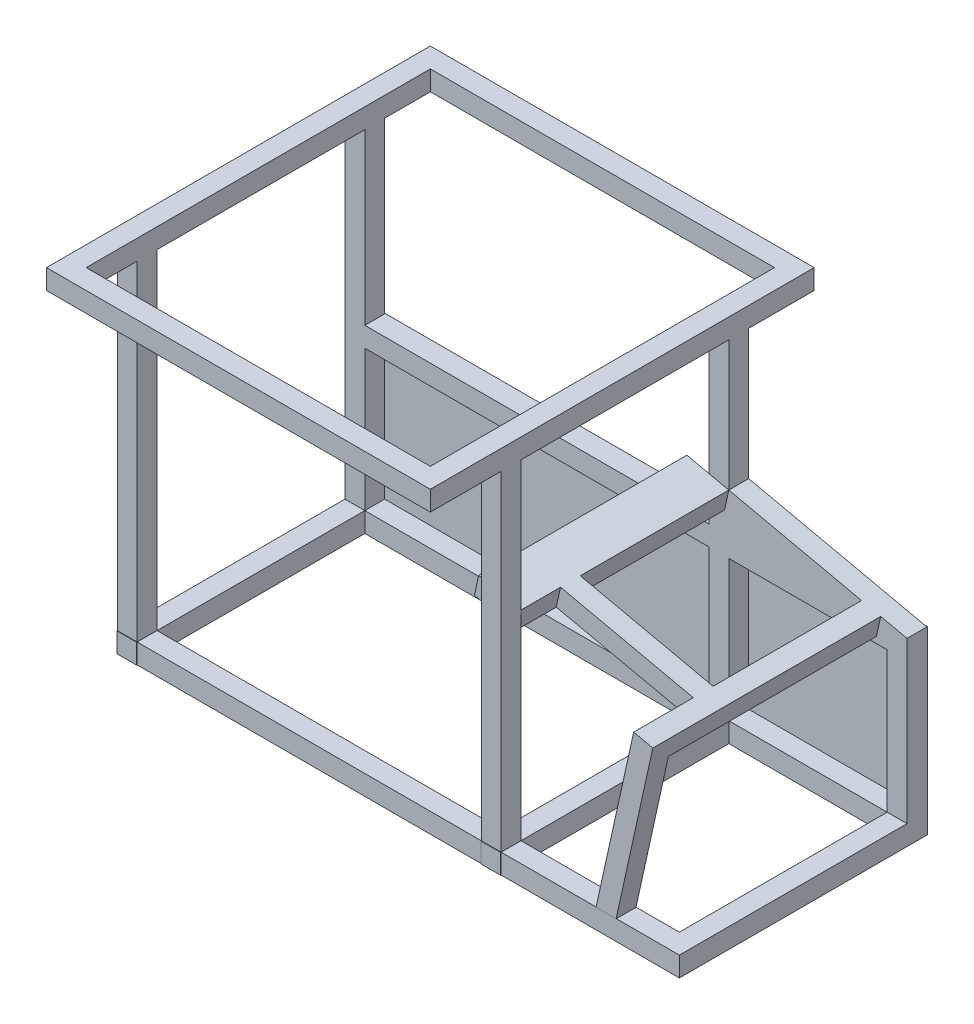
from build123d import *

# Parameters (mm, degrees)
CROQUIS1_W               = 491.3875
CROQUIS1_H               = 491.3875
CROQUIS1_W_2             = 440.5875
CROQUIS1_H_2             = 440.5875
SALIENTE_EXTRUIR1_DEPTH  = 25.4
CROQUIS2_W               = 25.4
CROQUIS2_H               = 25.4
SALIENTE_EXTRUIR2_DEPTH  = 422.312858808
CROQUIS3_W               = 25.4
CROQUIS3_H               = 25.4
SALIENTE_EXTRUIR3_DEPTH  = 25.4
SALIENTE_EXTRUIR4_REACH  = 813.249
CROQUIS4_W               = 25.4
CROQUIS4_H               = 25.4
CROQUIS5_W               = 25.4
CROQUIS5_H               = 25.4
SALIENTE_EXTRUIR5_DEPTH  = 292
SALIENTE_EXTRUIR7_REACH  = 813.249
CROQUIS7_W               = 25.4
CROQUIS7_H               = 25.4
SALIENTE_EXTRUIR9_DEPTH  = 25.4
SALIENTE_EXTRUIR10_DEPTH = 25.4
SALIENTE_EXTRUIR11_REACH = 950.384
CROQUIS11_W              = 25.4
CROQUIS11_H              = 25.4
SALIENTE_EXTRUIR12_DEPTH = 25.4
SALIENTE_EXTRUIR13_REACH = 932.183
CROQUIS13_W              = 25.087212933
CROQUIS13_H              = 25.4
SALIENTE_EXTRUIR8_DEPTH  = 0.79375


with BuildPart() as part:
    # Croquis1 → Saliente-Extruir1 (new body)
    with BuildSketch(Plane(origin=(0, 0, 0), x_dir=(1, 0, 0), z_dir=(0, 1, 0))):
        with Locations((220.29375, 220.29375)):
            Rectangle(CROQUIS1_W, CROQUIS1_H)
        with Locations((220.29375, 220.29375)):
            Rectangle(CROQUIS1_W_2, CROQUIS1_H_2, mode=Mode.SUBTRACT)
    extrude(amount=-SALIENTE_EXTRUIR1_DEPTH)

    # Croquis2 → Saliente-Extruir2 (add)
    with BuildSketch(Plane.XZ.offset(25.4)):
        with Locations((453.2875, -369.3875)):
            Rectangle(CROQUIS2_W, CROQUIS2_H)
        with Locations((-12.7, -369.3875)):
            Rectangle(CROQUIS2_W, CROQUIS2_H)
    extrude(amount=SALIENTE_EXTRUIR2_DEPTH)

    # Croquis3 → Saliente-Extruir3 (add)
    with BuildSketch(Plane.XZ.offset(447.712858808)):
        with Locations((-12.7, -369.3875)):
            Rectangle(CROQUIS3_W, CROQUIS3_H)
        with Locations((453.2875, -369.3875)):
            Rectangle(CROQUIS3_W, CROQUIS3_H)
    extrude(amount=SALIENTE_EXTRUIR3_DEPTH)

    # Croquis4 → Saliente-Extruir4 (add, up to next)
    with BuildSketch(Plane(origin=(0, 0, 0), x_dir=(0, 0, -1), z_dir=(1, 0, 0)), mode=Mode.PRIVATE) as saliente_extruir4_sk1:
        with Locations((369.3875, -460.412858808)):
            Rectangle(CROQUIS4_W, CROQUIS4_H)
    saliente_extruir4_tool1 = extrude(saliente_extruir4_sk1.sketch, amount=SALIENTE_EXTRUIR4_REACH, mode=Mode.PRIVATE) - part.part
    add(saliente_extruir4_tool1.solids().sort_by_distance((0, -460.412859, -369.3875))[0])

    # Croquis5 → Saliente-Extruir5 (add)
    with BuildSketch(Plane.XY.offset(-356.6875)):
        with Locations((-12.7, -460.412858808)):
            Rectangle(CROQUIS5_W, CROQUIS5_H)
        with Locations((453.2875, -460.412858808)):
            Rectangle(CROQUIS5_W, CROQUIS5_H)
    extrude(amount=SALIENTE_EXTRUIR5_DEPTH)

    # Croquis7 → Saliente-Extruir7 (add, up to next)
    with BuildSketch(Plane(origin=(0, 0, 0), x_dir=(0, 0, -1), z_dir=(1, 0, 0)), mode=Mode.PRIVATE) as saliente_extruir7_sk1:
        with Locations((369.3875, -255.012858808)):
            Rectangle(CROQUIS7_W, CROQUIS7_H)
    saliente_extruir7_tool1 = extrude(saliente_extruir7_sk1.sketch, amount=SALIENTE_EXTRUIR7_REACH, mode=Mode.PRIVATE) - part.part
    add(saliente_extruir7_tool1.solids().sort_by_distance((0, -255.012859, -369.3875))[0])

    # Croquis9 → Saliente-Extruir9 (add)
    with BuildSketch(Plane(origin=(0, -447.712858808, 0), x_dir=(1, 0, 0), z_dir=(0, 1, 0))):
        Polygon((465.9875, 382.0875), (694.147848124, 382.0875), (694.147848124, 65.242422269), (465.9875, 65.242422269), (0, 65.242422269), (0, 90.642422269), (465.9875, 90.642422269), (668.747848124, 90.642422269), (668.747848124, 356.6875), (465.9875, 356.6875), align=None)
    extrude(amount=-SALIENTE_EXTRUIR9_DEPTH)

    # Croquis10 → Saliente-Extruir10 (add)
    with BuildSketch(Plane.XY.offset(-356.6875)):
        Polygon((668.747848124, -447.712858808), (668.747848124, -267.712858808), (465.9875, -267.712858808), (465.9875, -191.947517804), (694.147848124, -242.312858808), (694.147848124, -447.712858808), align=None)
    extrude(amount=-SALIENTE_EXTRUIR10_DEPTH)

    # Croquis11 → Saliente-Extruir11 (add, up to next)
    with BuildSketch(Plane(origin=(0, -447.712858808, 0), x_dir=(1, 0, 0), z_dir=(0, 1, 0)), mode=Mode.PRIVATE) as saliente_extruir11_sk1:
        with Locations((-12.7, 77.942422269)):
            Rectangle(CROQUIS11_W, CROQUIS11_H)
    saliente_extruir11_tool1 = extrude(saliente_extruir11_sk1.sketch, amount=SALIENTE_EXTRUIR11_REACH, mode=Mode.PRIVATE) - part.part
    # Croquis11 → Saliente-Extruir11 (add, up to next)
    with BuildSketch(Plane(origin=(0, -447.712858808, 0), x_dir=(1, 0, 0), z_dir=(0, 1, 0)), mode=Mode.PRIVATE) as saliente_extruir11_sk2:
        with Locations((453.2875, 77.942422269)):
            Rectangle(CROQUIS11_W, CROQUIS11_H)
    saliente_extruir11_tool2 = extrude(saliente_extruir11_sk2.sketch, amount=SALIENTE_EXTRUIR11_REACH, mode=Mode.PRIVATE) - part.part
    add(saliente_extruir11_tool1.solids().sort_by_distance((-12.7, -447.712859, -77.942422))[0])
    add(saliente_extruir11_tool2.solids().sort_by_distance((453.2875, -447.712859, -77.942422))[0])

    # Croquis12 → Saliente-Extruir12 (add)
    with BuildSketch(Plane(origin=(-18.750939814, -84.943750412, 0), x_dir=(0.9764914853588178, -0.21555597653911102, 0), z_dir=(0.21555597653911102, 0.9764914853588178, 0))):
        Polygon((670.444567301, 356.6875), (670.444567301, 166.558874098), (496.408260678, 166.558874098), (496.408260678, 356.6875), (441.473637421, 356.6875), (441.473637421, 90.098891747), (496.408260678, 90.098891747), (496.408260678, 141.262403959), (670.444567301, 141.262403959), (670.444567301, 64.950724727), (695.531780234, 64.950724727), (695.531780234, 356.6875), align=None)
    extrude(amount=-SALIENTE_EXTRUIR12_DEPTH)

    # Saliente-Extruir13: up to this plane
    saliente_extruir13_end = Plane(origin=(0, -447.712858808, -64.6875), z_dir=(0, -1, 0))
    # Croquis13 → Saliente-Extruir13 (add, up to the surface)
    with BuildSketch(Plane(origin=(-24.226061618, -109.74663414, 0), x_dir=(0.9764914853588177, -0.21555597653911182, 0), z_dir=(-0.21555597653911182, -0.9764914853588177, 0)), mode=Mode.PRIVATE) as saliente_extruir13_sk1:
        with Locations((682.988173768, -77.650724727)):
            Rectangle(CROQUIS13_W, CROQUIS13_H)
    saliente_extruir13_tool1 = split(extrude(saliente_extruir13_sk1.sketch, amount=SALIENTE_EXTRUIR13_REACH, mode=Mode.PRIVATE), bisect_by=saliente_extruir13_end, keep=Keep.BOTH, mode=Mode.PRIVATE)
    add(saliente_extruir13_tool1.solids().sort_by_distance((642.706075, -256.968817, -77.650725))[0])

    # Croquis8 → Saliente-Extruir8 (add)
    with BuildSketch(Plane(origin=(0, 0, -382.0875), x_dir=(-1, 0, 0), z_dir=(0, 0, -1))):
        Polygon((-465.9875, -473.112858808), (25.4, -473.112858808), (25.4, -242.312858808), (-465.9875, -242.312858808), (-694.147848124, -242.312858808), (-694.147848124, -473.112858808), align=None)
    extrude(amount=SALIENTE_EXTRUIR8_DEPTH)


solid = part.part
